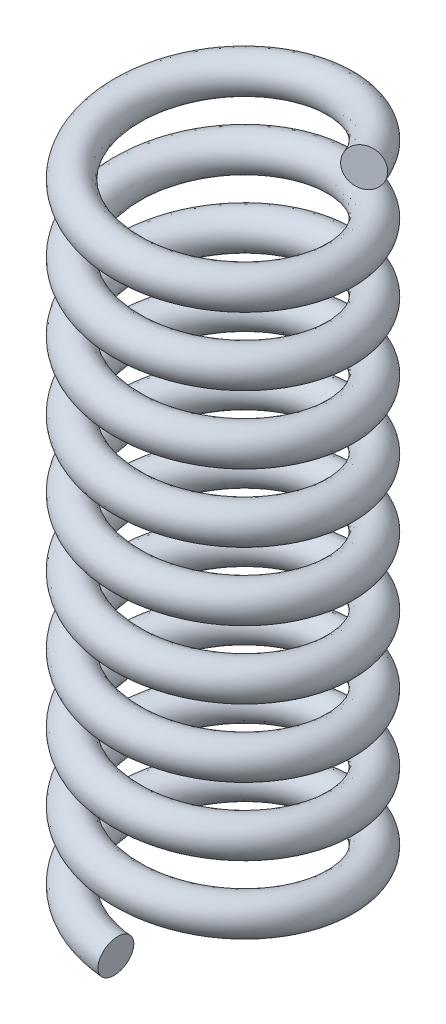
from build123d import *

# Parameters (mm, degrees)
SWEEP1_PITCH  = 19
SWEEP1_HEIGHT = 184
SWEEP1_RADIUS = 30
SKETCH2_R     = 5


with BuildPart() as part:
    # Sweep1: sweep along a helix
    with BuildLine() as sweep1_path:
        Helix(SWEEP1_PITCH, SWEEP1_HEIGHT, SWEEP1_RADIUS, center=(0, 0, 0), direction=(0, 1, 0), lefthand=True)
    # Sketch2 → Sweep1 (sweep)
    with BuildSketch(Plane(origin=(0, 0, 30), x_dir=(0, 0, 1), z_dir=(-0.9949582551571763, 0.10028993216962263, -1.336874068878081e-15))):
        Circle(SKETCH2_R)
    sweep(path=sweep1_path.line, is_frenet=True)


solid = part.part
